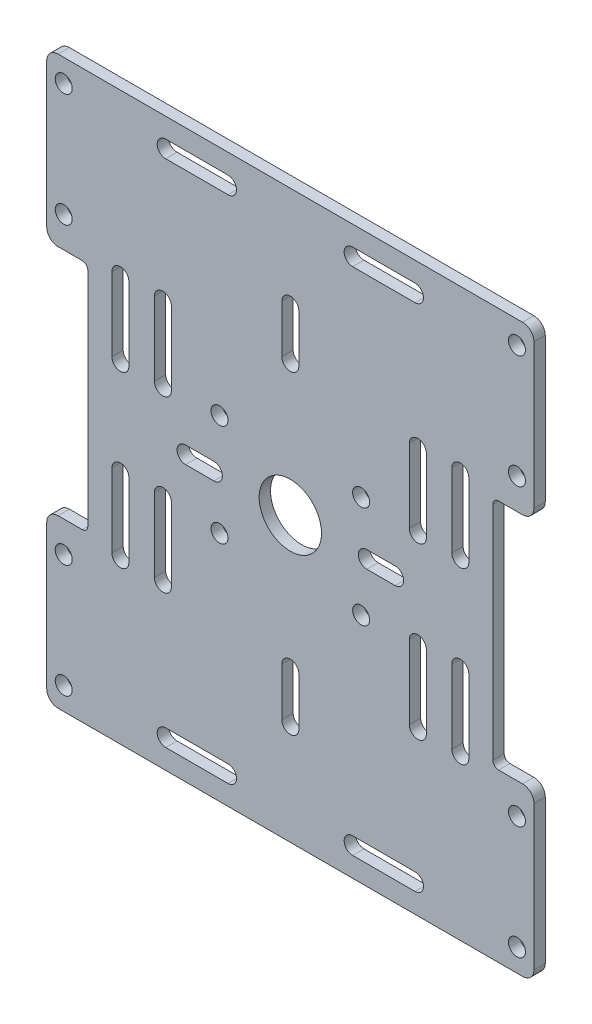
from build123d import *

# Parameters (mm, degrees)
SKETCH_1_R      = 5.5
SKETCH_1_R_2    = 1.5
EXTRUDE_1_DEPTH = 2
FILLET_1_R      = 1
FILLET_2_R      = 2


with BuildPart() as part:
    # 草圖1 → 填料-伸長1 (new body)
    with BuildSketch(Plane.XY):
        Polygon((-35.75, -20.56252042), (-43, -20.56252042), (-43, -50), (-25.75, -50), (25.75, -50), (43, -50), (43, -20.56252042), (35.75, -20.56252042), (35.75, 20.56252042), (43, 20.56252042), (43, 50), (25.75, 50), (-25.75, 50), (-43, 50), (-43, 20.56252042), (-35.75, 20.56252042), align=None)
        Circle(SKETCH_1_R, mode=Mode.SUBTRACT)
        with Locations((12.5, -9)):
            Circle(SKETCH_1_R_2, mode=Mode.SUBTRACT)
        with Locations(Location((-12.5, -9, 0), (0, 0, 180))):
            Circle(SKETCH_1_R_2, mode=Mode.SUBTRACT)
        with Locations(Location((12.5, 9, 0), (0, 0, 180))):
            Circle(SKETCH_1_R_2, mode=Mode.SUBTRACT)
        with Locations((-12.5, 9)):
            Circle(SKETCH_1_R_2, mode=Mode.SUBTRACT)
        with Locations((-40, -26)):
            Circle(SKETCH_1_R_2, mode=Mode.SUBTRACT)
        with Locations(Location((40, -26, 0), (0, 0, 180))):
            Circle(SKETCH_1_R_2, mode=Mode.SUBTRACT)
        with Locations((40, 26)):
            Circle(SKETCH_1_R_2, mode=Mode.SUBTRACT)
        with Locations(Location((-40, 26, 0), (0, 0, 180))):
            Circle(SKETCH_1_R_2, mode=Mode.SUBTRACT)
        with Locations((-40, -46)):
            Circle(SKETCH_1_R_2, mode=Mode.SUBTRACT)
        with Locations(Location((-40, 46, 0), (0, 0, 180))):
            Circle(SKETCH_1_R_2, mode=Mode.SUBTRACT)
        with Locations((40, 46)):
            Circle(SKETCH_1_R_2, mode=Mode.SUBTRACT)
        with Locations(Location((40, -46, 0), (0, 0, 180))):
            Circle(SKETCH_1_R_2, mode=Mode.SUBTRACT)
        with BuildLine():
            Line((13.5, 1.5), (18.5, 1.5))
            ThreePointArc((18.5, 1.5), (20, 0), (18.5, -1.5))
            Line((18.5, -1.5), (13.5, -1.5))
            ThreePointArc((13.5, -1.5), (12, 0), (13.5, 1.5))
        make_face(mode=Mode.SUBTRACT)
        with BuildLine():
            Line((24, -8.5), (24, -21.5))
            ThreePointArc((24, -21.5), (22.5, -23), (21, -21.5))
            Line((21, -21.5), (21, -8.5))
            ThreePointArc((21, -8.5), (22.5, -7), (24, -8.5))
        make_face(mode=Mode.SUBTRACT)
        with BuildLine():
            Line((31.5, -8.5), (31.5, -21.5))
            ThreePointArc((31.5, -21.5), (30, -23), (28.5, -21.5))
            Line((28.5, -21.5), (28.5, -8.5))
            ThreePointArc((28.5, -8.5), (30, -7), (31.5, -8.5))
        make_face(mode=Mode.SUBTRACT)
        with BuildLine():
            Line((31.5, 8.5), (31.5, 21.5))
            ThreePointArc((31.5, 21.5), (30, 23), (28.5, 21.5))
            Line((28.5, 21.5), (28.5, 8.5))
            ThreePointArc((28.5, 8.5), (30, 7), (31.5, 8.5))
        make_face(mode=Mode.SUBTRACT)
        with BuildLine():
            Line((24, 8.5), (24, 21.5))
            ThreePointArc((24, 21.5), (22.5, 23), (21, 21.5))
            Line((21, 21.5), (21, 8.5))
            ThreePointArc((21, 8.5), (22.5, 7), (24, 8.5))
        make_face(mode=Mode.SUBTRACT)
        with BuildLine():
            Line((-24, 8.5), (-24, 21.5))
            ThreePointArc((-24, 21.5), (-22.5, 23), (-21, 21.5))
            Line((-21, 21.5), (-21, 8.5))
            ThreePointArc((-21, 8.5), (-22.5, 7), (-24, 8.5))
        make_face(mode=Mode.SUBTRACT)
        with BuildLine():
            Line((-31.5, 8.5), (-31.5, 21.5))
            ThreePointArc((-31.5, 21.5), (-30, 23), (-28.5, 21.5))
            Line((-28.5, 21.5), (-28.5, 8.5))
            ThreePointArc((-28.5, 8.5), (-30, 7), (-31.5, 8.5))
        make_face(mode=Mode.SUBTRACT)
        with BuildLine():
            Line((-31.5, -8.5), (-31.5, -21.5))
            ThreePointArc((-31.5, -21.5), (-30, -23), (-28.5, -21.5))
            Line((-28.5, -21.5), (-28.5, -8.5))
            ThreePointArc((-28.5, -8.5), (-30, -7), (-31.5, -8.5))
        make_face(mode=Mode.SUBTRACT)
        with BuildLine():
            Line((-24, -8.5), (-24, -21.5))
            ThreePointArc((-24, -21.5), (-22.5, -23), (-21, -21.5))
            Line((-21, -21.5), (-21, -8.5))
            ThreePointArc((-21, -8.5), (-22.5, -7), (-24, -8.5))
        make_face(mode=Mode.SUBTRACT)
        with BuildLine():
            Line((-22, -43.5), (-11, -43.5))
            ThreePointArc((-11, -43.5), (-9.5, -45), (-11, -46.5))
            Line((-11, -46.5), (-22, -46.5))
            ThreePointArc((-22, -46.5), (-23.5, -45), (-22, -43.5))
        make_face(mode=Mode.SUBTRACT)
        with BuildLine():
            Line((22, -43.5), (11, -43.5))
            ThreePointArc((11, -43.5), (9.5, -45), (11, -46.5))
            Line((11, -46.5), (22, -46.5))
            ThreePointArc((22, -46.5), (23.5, -45), (22, -43.5))
        make_face(mode=Mode.SUBTRACT)
        with BuildLine():
            Line((22, 43.5), (11, 43.5))
            ThreePointArc((11, 43.5), (9.5, 45), (11, 46.5))
            Line((11, 46.5), (22, 46.5))
            ThreePointArc((22, 46.5), (23.5, 45), (22, 43.5))
        make_face(mode=Mode.SUBTRACT)
        with BuildLine():
            Line((-22, 43.5), (-11, 43.5))
            ThreePointArc((-11, 43.5), (-9.5, 45), (-11, 46.5))
            Line((-11, 46.5), (-22, 46.5))
            ThreePointArc((-22, 46.5), (-23.5, 45), (-22, 43.5))
        make_face(mode=Mode.SUBTRACT)
        with BuildLine():
            Line((-13.5, 1.5), (-18.5, 1.5))
            ThreePointArc((-18.5, 1.5), (-20, 0), (-18.5, -1.5))
            Line((-18.5, -1.5), (-13.5, -1.5))
            ThreePointArc((-13.5, -1.5), (-12, 0), (-13.5, 1.5))
        make_face(mode=Mode.SUBTRACT)
        with BuildLine():
            Line((1.5, -23.5), (1.5, -32))
            ThreePointArc((1.5, -32), (0, -33.5), (-1.5, -32))
            Line((-1.5, -32), (-1.5, -23.5))
            ThreePointArc((-1.5, -23.5), (0, -22), (1.5, -23.5))
        make_face(mode=Mode.SUBTRACT)
        with BuildLine():
            Line((1.5, 23.5), (1.5, 32))
            ThreePointArc((1.5, 32), (0, 33.5), (-1.5, 32))
            Line((-1.5, 32), (-1.5, 23.5))
            ThreePointArc((-1.5, 23.5), (0, 22), (1.5, 23.5))
        make_face(mode=Mode.SUBTRACT)
    extrude(amount=EXTRUDE_1_DEPTH)

    # 圓角1
    fillet_1_edges = [part.edges().sort_by_distance(p)[0] for p in [
        (35.75, 20.56252042, 1),
        (35.75, -20.56252042, 1),
        (-35.75, -20.56252042, 1),
        (-35.75, 20.56252042, 1),
    ]]
    fillet(fillet_1_edges, radius=FILLET_1_R)

    # 圓角2
    fillet_2_edges = [part.edges().sort_by_distance(p)[0] for p in [
        (43, 50, 1),
        (43, 20.56252042, 1),
        (43, -20.56252042, 1),
        (43, -50, 1),
        (-43, -50, 1),
        (-43, -20.56252042, 1),
        (-43, 20.56252042, 1),
        (-43, 50, 1),
    ]]
    fillet(fillet_2_edges, radius=FILLET_2_R)


solid = part.part
